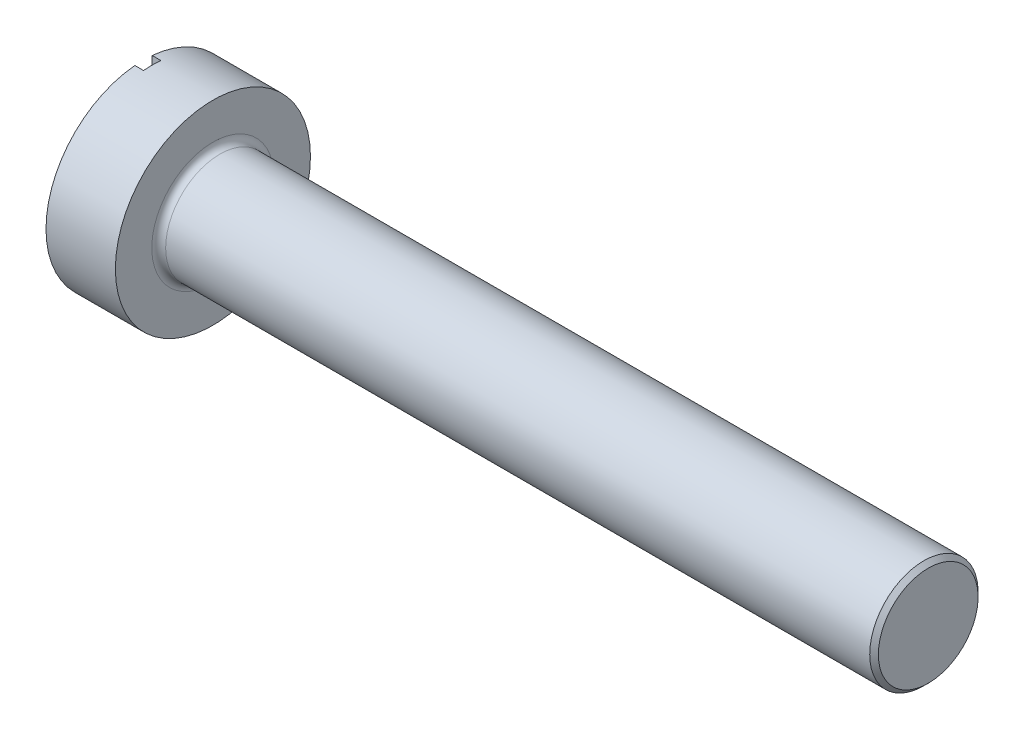
from build123d import *

# Parameters (mm, degrees)
CHAMFER1_SIZE       = 0.1
FILLET1_R           = 0.16
EXTRUDE1_DEPTH      = 19.377567848
EXTRUDE1_DEPTH_BACK = 19.377567848
SKETCH2_W           = 0.2
SKETCH2_H           = 0.2


with BuildPart() as part:
    # Sketch1 → Revolve1 (revolve)
    with BuildSketch(Plane.XY, mode=Mode.PRIVATE) as revolve1_sk:
        Polygon((0, 2.25), (0, 0), (18.1, 0), (18.1, 1.25), (1.6, 1.25), (1.6, 2.25), align=None)
    revolve(revolve1_sk.sketch.rotate(Axis((0, 0, 0), (1, 0, 0)), 90), axis=Axis((0, 0, 0), (1, 0, 0)))

    # Chamfer1
    chamfer1_edges = [part.edges().sort_by_distance(p)[0] for p in [
        (18.1, 0, -1.25),
    ]]
    chamfer(chamfer1_edges, length=CHAMFER1_SIZE)

    # Fillet1
    fillet1_edges = [part.edges().sort_by_distance(p)[0] for p in [
        (1.6, 0, -1.25),
    ]]
    fillet(fillet1_edges, radius=FILLET1_R)

    # Sketch2 → Extrude1 (cut, two sides: drawn at the far end of the back side and taken through both)
    with BuildSketch(Plane(origin=(0, 0, 0), x_dir=(1, 0, 0), z_dir=(0, 1, 0)).offset(-EXTRUDE1_DEPTH_BACK)):
        with Locations((0.1, -0.1)):
            Rectangle(SKETCH2_W, SKETCH2_H)
        with Locations((0.1, 0.1)):
            Rectangle(SKETCH2_W, SKETCH2_H)
    extrude(amount=EXTRUDE1_DEPTH + EXTRUDE1_DEPTH_BACK, mode=Mode.SUBTRACT)


solid = part.part
